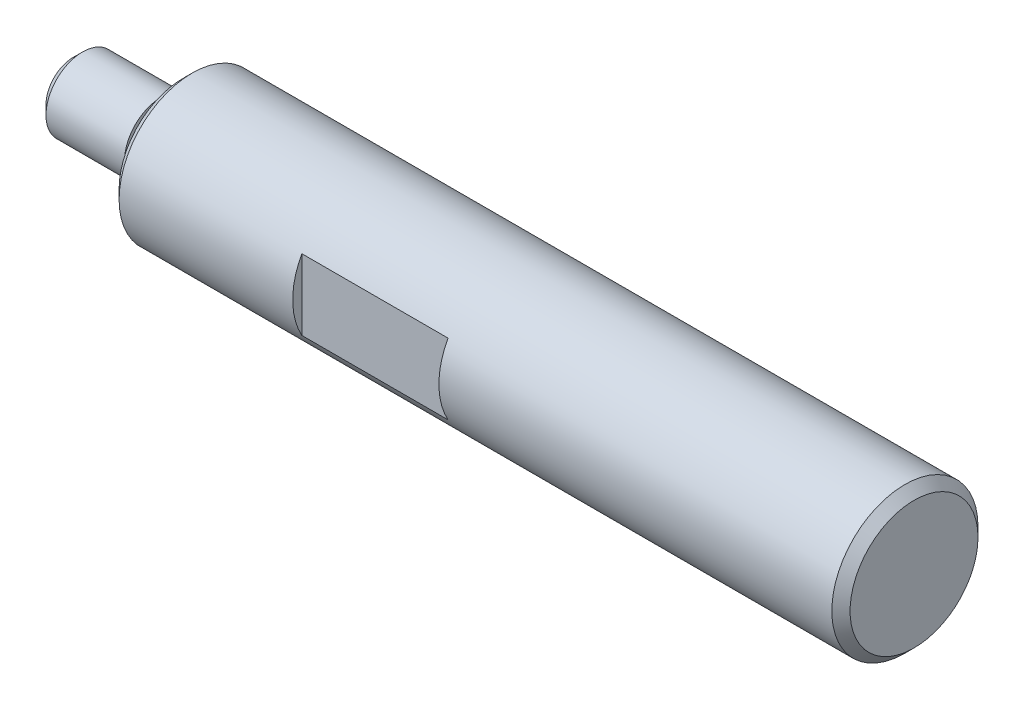
from build123d import *

# Parameters (mm, degrees)
CUT_EXTRUDE1_DEPTH = 8
CUT_EXTRUDE2_DEPTH = 8
CHAMFER1_SIZE      = 0.5


with BuildPart() as part:
    # Sketch1 → Revolve1 (revolve)
    with BuildSketch(Plane.XY):
        Polygon((-6, 2), (-6, 0), (40, 0), (40, 4), (0, 4), (0, 1.6), (-1.2, 1.6), (-1.2, 2), align=None)
    revolve(axis=Axis((-6, 0, 0), (1, 0, 0)))

    # Sketch2 → Cut-Extrude1 (cut)
    with BuildSketch(Plane(origin=(10, 0, 0), x_dir=(0, -1, 0), z_dir=(-1, 0, 0))):
        with BuildLine():
            Line((1.936491673, -3.5), (-1.936491673, -3.5))
            ThreePointArc((-1.936491673, -3.5), (0, -4), (1.936491673, -3.5))
        make_face()
    extrude(amount=-CUT_EXTRUDE1_DEPTH, mode=Mode.SUBTRACT)

    # Sketch3 → Cut-Extrude2 (cut)
    with BuildSketch(Plane(origin=(10, 0, 0), x_dir=(0, -1, 0), z_dir=(-1, 0, 0))):
        with BuildLine():
            Line((-1.936491622, 3.500000028), (1.936491622, 3.500000028))
            ThreePointArc((1.936491622, 3.500000028), (0, 4), (-1.936491622, 3.500000028))
        make_face()
    extrude(amount=-CUT_EXTRUDE2_DEPTH, mode=Mode.SUBTRACT)

    # Chamfer1
    chamfer1_edges = [part.edges().sort_by_distance(p)[0] for p in [
        (-6, -2, 0),
        (40, -4, 0),
        (0, -4, 0),
    ]]
    chamfer(chamfer1_edges, length=CHAMFER1_SIZE)


solid = part.part
